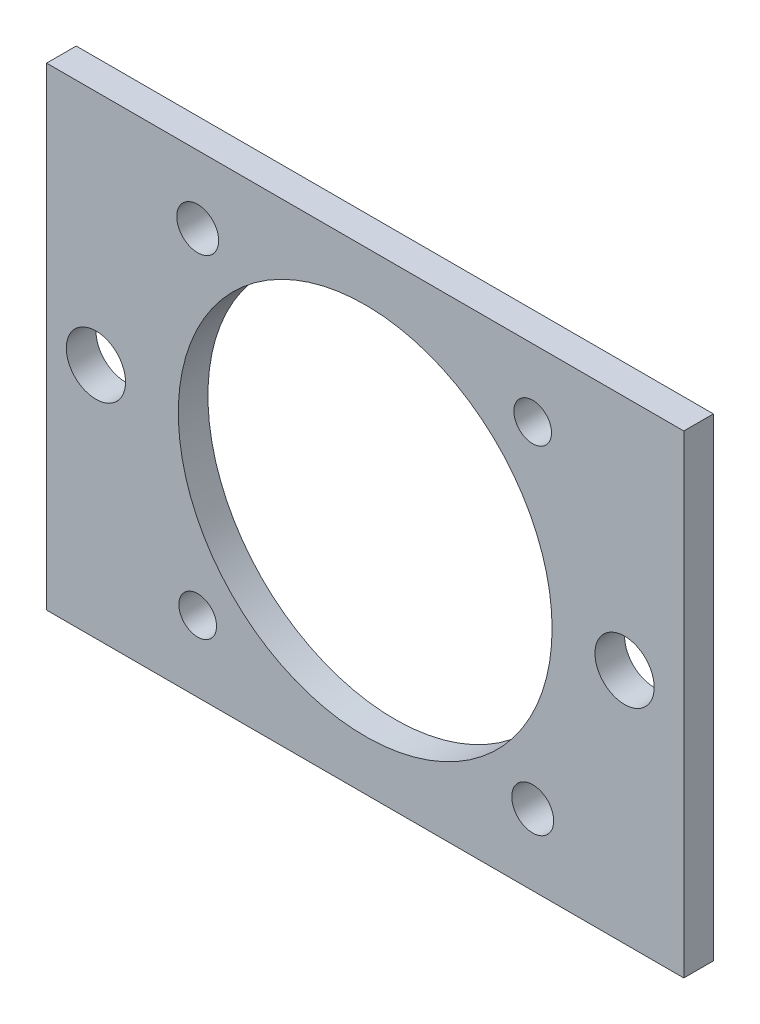
from build123d import *

# Parameters (mm, degrees)
SKETCH2_W           = 68.326
SKETCH2_H           = 50.8
SKETCH2_R           = 2.2479
SKETCH2_R_2         = 2.0193
SKETCH2_R_3         = 20.0406
SKETCH2_R_4         = 3.175
BOSS_EXTRUDE1_DEPTH = 3.175


with BuildPart() as part:
    # Sketch2 → Boss-Extrude1 (new body)
    with BuildSketch(Plane.XY):
        Rectangle(SKETCH2_W, SKETCH2_H)
        with Locations((-17.960512242, 18.133232242)):
            Circle(SKETCH2_R, mode=Mode.SUBTRACT)
        with Locations((17.960512242, 18.133232242)):
            Circle(SKETCH2_R_2, mode=Mode.SUBTRACT)
        with Locations((17.960512242, -17.787792242)):
            Circle(SKETCH2_R, mode=Mode.SUBTRACT)
        with Locations((-17.960512242, -17.787792242)):
            Circle(SKETCH2_R_2, mode=Mode.SUBTRACT)
        Circle(SKETCH2_R_3, mode=Mode.SUBTRACT)
        with Locations((-28.874829799, 0)):
            Circle(SKETCH2_R_4, mode=Mode.SUBTRACT)
        with Locations((27.813, 0)):
            Circle(SKETCH2_R_4, mode=Mode.SUBTRACT)
    extrude(amount=BOSS_EXTRUDE1_DEPTH)


solid = part.part
